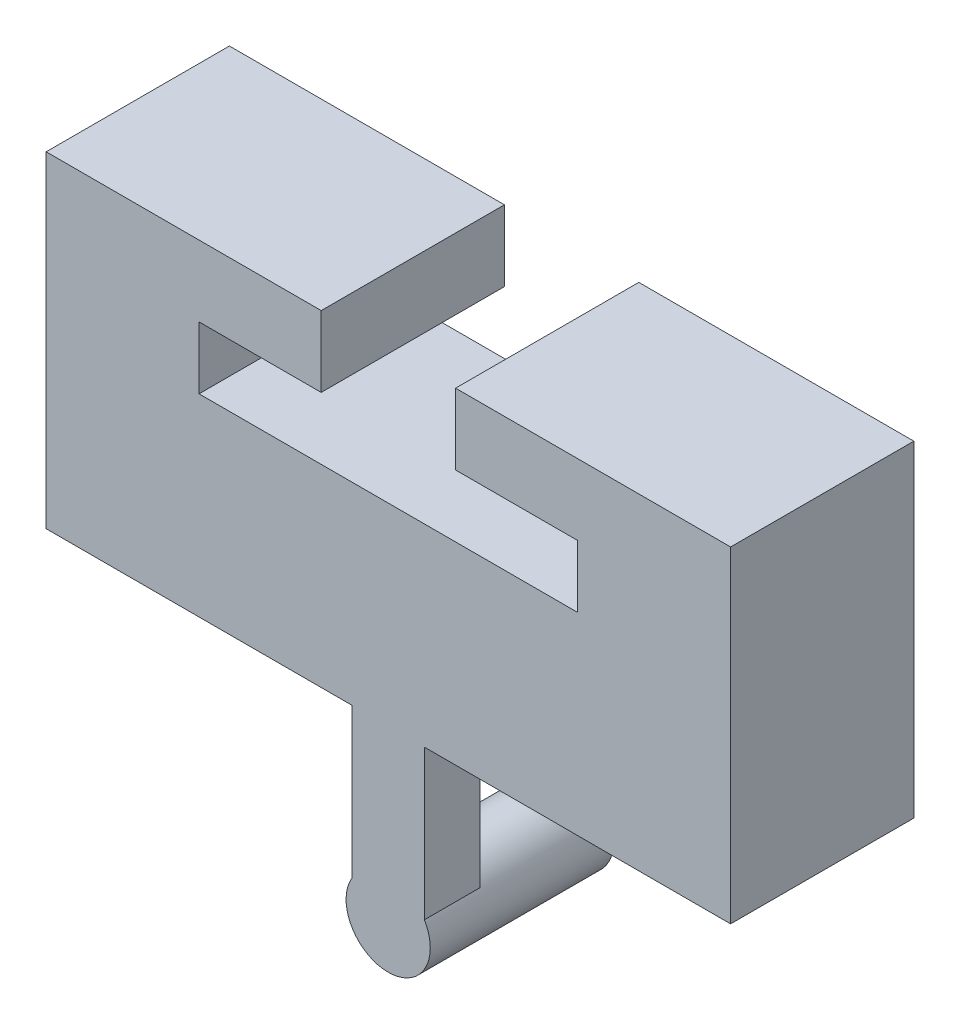
from build123d import *

# Parameters (mm, degrees)
BOSS_EXTRUDE1_DEPTH = 38.1
SKETCH2_R           = 8.7503
BOSS_EXTRUDE2_DEPTH = 38.1
BOSS_EXTRUDE6_DEPTH = 11.572281197


with BuildPart() as part:
    # Sketch1 → Boss-Extrude1 (new body)
    with BuildSketch(Plane.XY):
        Polygon((0, 0), (142.319474343, 0), (142.319474343, 67.883016851), (85.129737171, 67.883016851), (85.129737171, 53.144138708), (110.529737171, 53.144138708), (110.529737171, 40.190138708), (31.789737171, 40.190138708), (31.789737171, 53.144138708), (57.189737171, 53.144138708), (57.189737171, 67.883016851), (0, 67.883016851), align=None)
    extrude(amount=BOSS_EXTRUDE1_DEPTH)



with BuildPart() as body_2:
    # Sketch2 → Boss-Extrude2 (new body)
    with BuildSketch(Plane.XY.offset(38.1)):
        with Locations((71.120000025, -35.559977798)):
            Circle(SKETCH2_R)
    extrude(amount=-BOSS_EXTRUDE2_DEPTH)


with BuildPart() as part_1:
    add(part.part)

    add(body_2.part)  # Boss-Extrude6 merges body 2
    # Sketch8 → Boss-Extrude6 (add)
    with BuildSketch(Plane.XY.offset(38.1)):
        with BuildLine():
            Line((63.59200581, -40.020589099), (63.59200581, 0))
            Line((63.59200581, 0), (78.647994227, 0))
            Line((78.647994227, 0), (78.647994227, -40.020589121))
            ThreePointArc((78.647994227, -40.020589121), (71.120000012, -44.310277798), (63.59200581, -40.020589099))
        make_face()
    extrude(amount=-BOSS_EXTRUDE6_DEPTH)


solid = part_1.part
